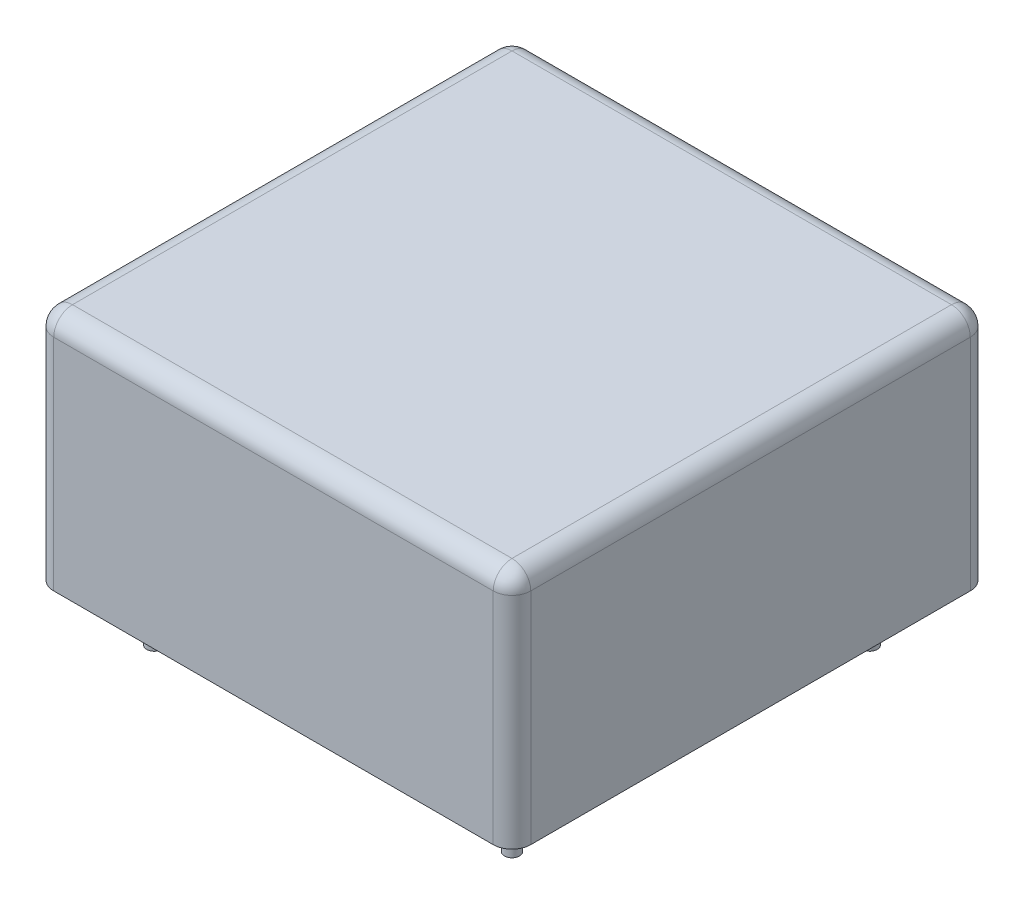
from build123d import *

# Parameters (mm, degrees)
SKETCH_2_R        = 0.4
EXTRUDE_1_DEPTH   = 3
EXTRUDE_1_2_DEPTH = 3
EXTRUDE_1_3_DEPTH = 3
EXTRUDE_1_4_DEPTH = 3
EXTRUDE_1_5_DEPTH = 3
EXTRUDE_2_DEPTH   = 12.7
FILLET_1_R        = 1


with BuildPart() as part:
    # Эскиз2 → Бобышка-Вытянуть1 (new body)
    with BuildSketch(Plane(origin=(0, 0, 0), x_dir=(1, 0, 0), z_dir=(0, 1, 0))):
        with Locations(Location((0, 0, 0), (0, 0, 270))):
            Circle(SKETCH_2_R)
    extrude(amount=-EXTRUDE_1_DEPTH)



with BuildPart() as body_2:
    # Эскиз2 → Extrude 1 2 (new body)
    with BuildSketch(Plane(origin=(0, 0, 0), x_dir=(1, 0, 0), z_dir=(0, 1, 0))):
        with Locations(Location((9.525, 0, 0), (0, 0, 270))):
            Circle(SKETCH_2_R)
    extrude(amount=-EXTRUDE_1_2_DEPTH)


with BuildPart() as body_3:
    # Эскиз2 → Extrude 1 3 (new body)
    with BuildSketch(Plane(origin=(0, 0, 0), x_dir=(1, 0, 0), z_dir=(0, 1, 0))):
        with Locations(Location((0, -19.05, 0), (0, 0, 270))):
            Circle(SKETCH_2_R)
    extrude(amount=-EXTRUDE_1_3_DEPTH)


with BuildPart() as body_4:
    # Эскиз2 → Extrude 1 4 (new body)
    with BuildSketch(Plane(origin=(0, 0, 0), x_dir=(1, 0, 0), z_dir=(0, 1, 0))):
        with Locations(Location((19.05, -19.05, 0), (0, 0, 270))):
            Circle(SKETCH_2_R)
    extrude(amount=-EXTRUDE_1_4_DEPTH)


with BuildPart() as body_5:
    # Эскиз2 → Extrude 1 5 (new body)
    with BuildSketch(Plane(origin=(0, 0, 0), x_dir=(1, 0, 0), z_dir=(0, 1, 0))):
        with Locations(Location((19.05, 0, 0), (0, 0, 270))):
            Circle(SKETCH_2_R)
    extrude(amount=-EXTRUDE_1_5_DEPTH)


with BuildPart() as part_1:
    add(part.part)

    add(body_2.part)  # Бобышка-Вытянуть2 merges body 2

    add(body_3.part)  # Бобышка-Вытянуть2 merges body 3

    add(body_4.part)  # Бобышка-Вытянуть2 merges body 4

    add(body_5.part)  # Бобышка-Вытянуть2 merges body 5
    # Эскиз3 → Бобышка-Вытянуть2 (add)
    with BuildSketch(Plane(origin=(0, 0, 0), x_dir=(1, 0, 0), z_dir=(0, 1, 0))):
        with BuildLine():
            Line((-2.175, 3.175), (21.225, 3.175))
            ThreePointArc((21.225, 3.175), (21.932106781, 2.882106781), (22.225, 2.175))
            Line((22.225, 2.175), (22.225, -21.225))
            ThreePointArc((22.225, -21.225), (21.932106781, -21.932106781), (21.225, -22.225))
            Line((21.225, -22.225), (-2.175, -22.225))
            ThreePointArc((-2.175, -22.225), (-2.882106781, -21.932106781), (-3.175, -21.225))
            Line((-3.175, -21.225), (-3.175, 2.175))
            ThreePointArc((-3.175, 2.175), (-2.882106781, 2.882106781), (-2.175, 3.175))
        make_face()
    extrude(amount=EXTRUDE_2_DEPTH)

    # Скругление1
    fillet_1_edges = [part_1.edges().sort_by_distance(p)[0] for p in [
        (22.225, 12.7, 9.525),
        (21.932106781, 12.7, -2.882106781),
        (9.525, 12.7, -3.175),
        (-2.882106781, 12.7, -2.882106781),
        (-3.175, 12.7, 9.525),
        (-2.882106781, 12.7, 21.932106781),
        (9.525, 12.7, 22.225),
        (21.932106781, 12.7, 21.932106781),
    ]]
    fillet(fillet_1_edges, radius=FILLET_1_R)


solid = part_1.part
